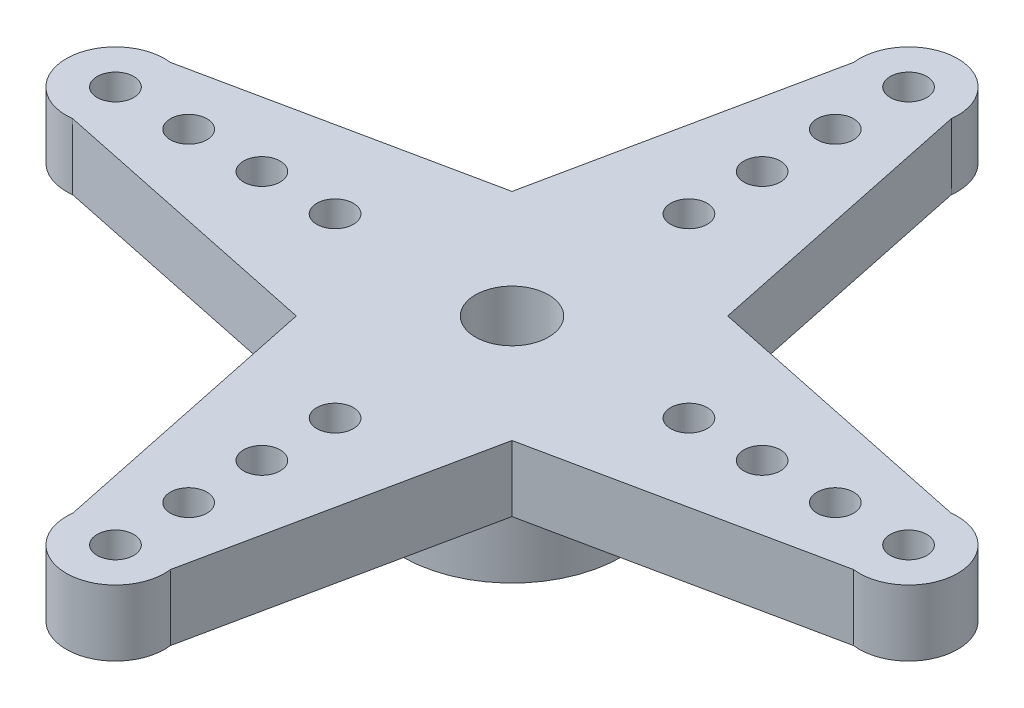
from build123d import *

# Parameters (mm, degrees)
SKETCH1_R           = 4.5
SKETCH1_R_2         = 2.5
BOSS_EXTRUDE1_DEPTH = 3.6
SKETCH2_R           = 0.75
SKETCH2_R_2         = 6.25
SKETCH2_R_3         = 4.5
SKETCH2_R_4         = 2.5
SKETCH2_R_5         = 1.5
BOSS_EXTRUDE2_DEPTH = 2.7
SKETCH3_W           = 3
SKETCH3_H           = 0.5
SKETCH3_W_2         = 0.5
SKETCH3_H_2         = 3
BOSS_EXTRUDE3_DEPTH = 0.5


with BuildPart() as part:
    # Sketch1 → Boss-Extrude1 (new body)
    with BuildSketch(Plane(origin=(0, 0, 0), x_dir=(1, 0, 0), z_dir=(0, 1, 0))):
        with Locations(Location((0, 0, 0), (0, 0, 270))):
            Circle(SKETCH1_R)
        with Locations(Location((0, 0, 0), (0, 0, 270))):
            Circle(SKETCH1_R_2, mode=Mode.SUBTRACT)
    extrude(amount=BOSS_EXTRUDE1_DEPTH)

    # Sketch2 → Boss-Extrude2 (add)
    # profile 1 of 7: a face of its own
    with BuildSketch(Plane(origin=(0, 3.6, 0), x_dir=(1, 0, 0), z_dir=(0, 1, 0))):
        with BuildLine():
            ThreePointArc((4.419417382, -4.419417382), (0, -6.25), (-4.419417382, -4.419417382))
            Line((-4.419417382, -4.419417382), (-2, -16))
            ThreePointArc((-2, -16), (0, -18.265564437), (2, -16))
            Line((2, -16), (4.419417382, -4.419417382))
        make_face()
        with Locations(Location((0, -16.25, 0), (0, 0, 90))):
            Circle(SKETCH2_R, mode=Mode.SUBTRACT)
        with Locations(Location((0, -13.25, 0), (0, 0, 90))):
            Circle(SKETCH2_R, mode=Mode.SUBTRACT)
        with Locations(Location((0, -10.25, 0), (0, 0, 90))):
            Circle(SKETCH2_R, mode=Mode.SUBTRACT)
        with Locations(Location((0, -7.25, 0), (0, 0, 90))):
            Circle(SKETCH2_R, mode=Mode.SUBTRACT)
    # profile 2 of 7: a face of its own
    with BuildSketch(Plane(origin=(0, 3.6, 0), x_dir=(1, 0, 0), z_dir=(0, 1, 0))):
        with BuildLine():
            ThreePointArc((-4.419417382, -4.419417382), (-6.25, 0), (-4.419417382, 4.419417382))
            Line((-4.419417382, 4.419417382), (-16, 2))
            ThreePointArc((-16, 2), (-18.265564437, 0), (-16, -2))
            Line((-16, -2), (-4.419417382, -4.419417382))
        make_face()
        with Locations(Location((-16.25, 0, 0), (0, 0, 90))):
            Circle(SKETCH2_R, mode=Mode.SUBTRACT)
        with Locations(Location((-13.25, 0, 0), (0, 0, 90))):
            Circle(SKETCH2_R, mode=Mode.SUBTRACT)
        with Locations(Location((-10.25, 0, 0), (0, 0, 90))):
            Circle(SKETCH2_R, mode=Mode.SUBTRACT)
        with Locations(Location((-7.25, 0, 0), (0, 0, 90))):
            Circle(SKETCH2_R, mode=Mode.SUBTRACT)
    # profile 3 of 7: a face of its own
    with BuildSketch(Plane(origin=(0, 3.6, 0), x_dir=(1, 0, 0), z_dir=(0, 1, 0))):
        Circle(SKETCH2_R_2)
        with Locations(Location((0, 0, 0), (0, 0, 270))):
            Circle(SKETCH2_R_3, mode=Mode.SUBTRACT)
    # profile 4 of 7: a face of its own
    with BuildSketch(Plane(origin=(0, 3.6, 0), x_dir=(1, 0, 0), z_dir=(0, 1, 0))):
        with BuildLine():
            ThreePointArc((2, 16), (0, 18.265564437), (-2, 16))
            Line((-2, 16), (-4.419417382, 4.419417382))
            ThreePointArc((-4.419417382, 4.419417382), (0, 6.25), (4.419417382, 4.419417382))
            Line((4.419417382, 4.419417382), (2, 16))
        make_face()
        with Locations(Location((0, 7.25, 0), (0, 0, 90))):
            Circle(SKETCH2_R, mode=Mode.SUBTRACT)
        with Locations(Location((0, 10.25, 0), (0, 0, 90))):
            Circle(SKETCH2_R, mode=Mode.SUBTRACT)
        with Locations(Location((0, 13.25, 0), (0, 0, 90))):
            Circle(SKETCH2_R, mode=Mode.SUBTRACT)
        with Locations(Location((0, 16.25, 0), (0, 0, 90))):
            Circle(SKETCH2_R, mode=Mode.SUBTRACT)
    # profile 5 of 7: a face of its own
    with BuildSketch(Plane(origin=(0, 3.6, 0), x_dir=(1, 0, 0), z_dir=(0, 1, 0))):
        with BuildLine():
            Line((16, 2), (4.419417382, 4.419417382))
            ThreePointArc((4.419417382, 4.419417382), (5.774247078, 2.391771452), (6.25, 0))
            ThreePointArc((6.25, 0), (5.774247078, -2.391771452), (4.419417382, -4.419417382))
            Line((4.419417382, -4.419417382), (16, -2))
            ThreePointArc((16, -2), (18.265564437, 0), (16, 2))
        make_face()
        with Locations(Location((7.25, 0, 0), (0, 0, 90))):
            Circle(SKETCH2_R, mode=Mode.SUBTRACT)
        with Locations(Location((10.25, 0, 0), (0, 0, 90))):
            Circle(SKETCH2_R, mode=Mode.SUBTRACT)
        with Locations(Location((13.25, 0, 0), (0, 0, 90))):
            Circle(SKETCH2_R, mode=Mode.SUBTRACT)
        with Locations(Location((16.25, 0, 0), (0, 0, 90))):
            Circle(SKETCH2_R, mode=Mode.SUBTRACT)
    # profile 6 of 7: a face of its own
    with BuildSketch(Plane(origin=(0, 3.6, 0), x_dir=(1, 0, 0), z_dir=(0, 1, 0))):
        with Locations(Location((0, 0, 0), (0, 0, 270))):
            Circle(SKETCH2_R_3)
        with Locations(Location((0, 0, 0), (0, 0, 270))):
            Circle(SKETCH2_R_4, mode=Mode.SUBTRACT)
    # profile 7 of 7: a face of its own
    with BuildSketch(Plane(origin=(0, 3.6, 0), x_dir=(1, 0, 0), z_dir=(0, 1, 0))):
        with Locations(Location((0, 0, 0), (0, 0, 270))):
            Circle(SKETCH2_R_4)
        with Locations(Location((0, 0, 0), (0, 0, 90))):
            Circle(SKETCH2_R_5, mode=Mode.SUBTRACT)
    extrude(amount=BOSS_EXTRUDE2_DEPTH)

    # Sketch3 → Boss-Extrude3 (add)
    with BuildSketch(Plane.XZ.offset(-3.6)):
        with Locations((-6.336645362, -2.094924186)):
            Rectangle(SKETCH3_W, SKETCH3_H)
        with Locations((-2.456041922, -7.328306568)):
            Rectangle(SKETCH3_W_2, SKETCH3_H_2)
    extrude(amount=BOSS_EXTRUDE3_DEPTH)


solid = part.part
